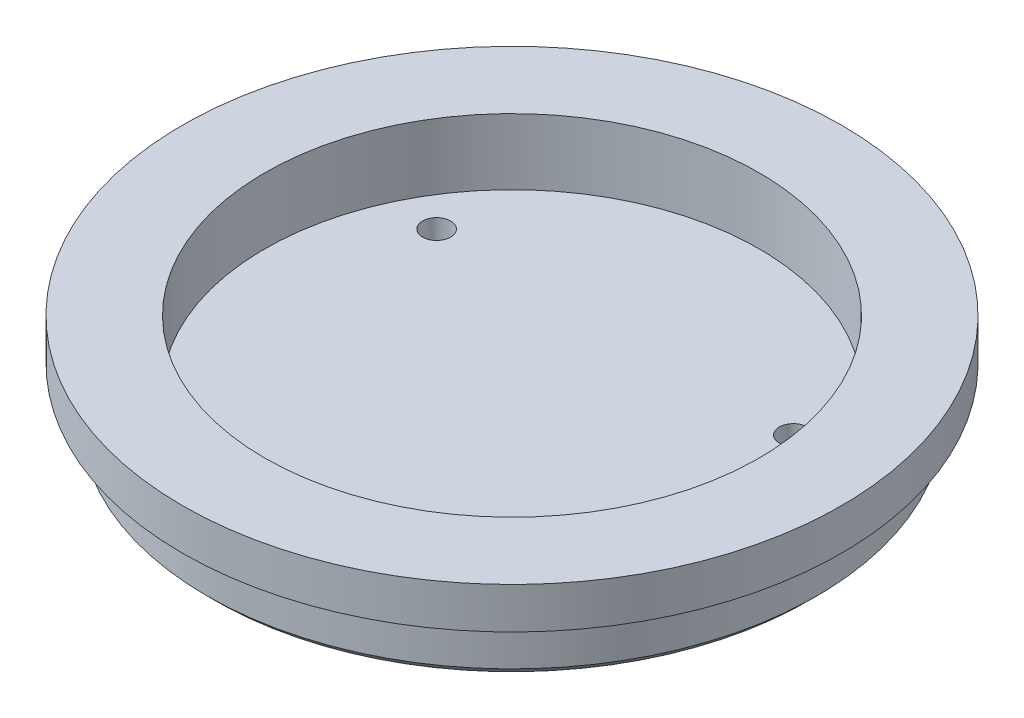
from build123d import *

# Parameters (mm, degrees)
CHAMFER_1_SIZE      = 1
HOLE_WIZARD_M3_1_D  = 3.4
SKETCH_4_R          = 30
CUT_EXTRUDE_1_DEPTH = 8


with BuildPart() as part:
    # 草图1 → 旋转1 (revolve)
    with BuildSketch(Plane(origin=(0, 0, 0), x_dir=(0, 0, -1), z_dir=(1, 0, 0))):
        Polygon((0, 0), (37, 0), (37, 7), (40, 7), (40, 12), (0, 12), align=None)
    revolve(axis=Axis((0, 0, 0), (0, 1, 0)))

    # 倒角1
    chamfer_1_edges = [part.edges().sort_by_distance(p)[0] for p in [
        (0, 0, 37),
    ]]
    chamfer(chamfer_1_edges, length=CHAMFER_1_SIZE)

    # M3 间隙孔1 (through all)
    with Locations(Plane(origin=(0, 12, 0), x_dir=(-1, 0, 0), z_dir=(0, 1, 0))):
        with Locations((0, 25), (-21.650635095, -12.5), (21.650635095, -12.5)):
            Hole(HOLE_WIZARD_M3_1_D / 2)

    # 草图4 → 切除-拉伸1 (cut)
    with BuildSketch(Plane(origin=(0, 12, 0), x_dir=(1, 0, 0), z_dir=(0, 1, 0))):
        with Locations(Location((0, 0, 0), (0, 0, 270))):
            Circle(SKETCH_4_R)
    extrude(amount=-CUT_EXTRUDE_1_DEPTH, mode=Mode.SUBTRACT)


solid = part.part
